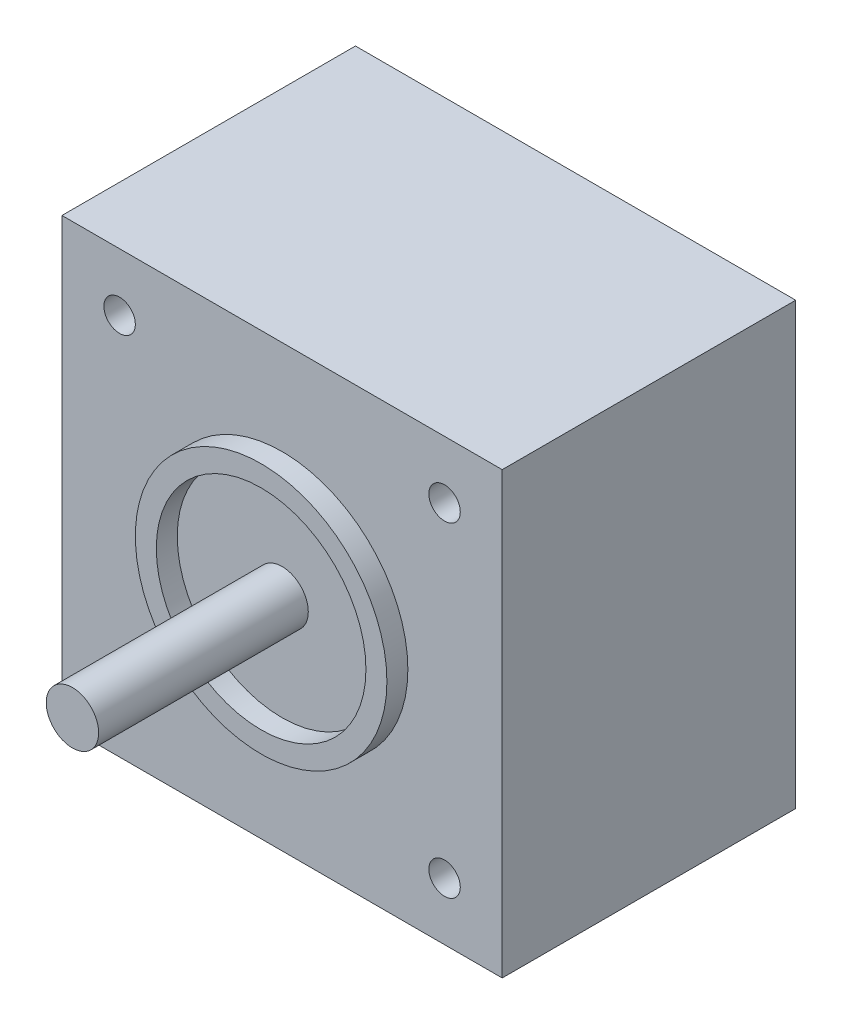
from build123d import *

# Parameters (mm, degrees)
SKETCH2_W           = 42
SKETCH2_H           = 42
BOSS_EXTRUDE1_DEPTH = 28
SKETCH3_R           = 1.5
CUT_EXTRUDE1_DEPTH  = 10
SKETCH4_R           = 12
BOSS_EXTRUDE2_DEPTH = 2
SKETCH5_R           = 10
CUT_EXTRUDE2_DEPTH  = 2
SKETCH6_R           = 2.5
BOSS_EXTRUDE3_DEPTH = 20
SKETCH7_W           = 15
SKETCH7_H           = 8
BOSS_EXTRUDE4_DEPTH = 6
SKETCH8_W           = 13
SKETCH8_H           = 6
CUT_EXTRUDE4_DEPTH  = 6


with BuildPart() as part:
    # Sketch2 → Boss-Extrude1 (new body)
    with BuildSketch(Plane.XY):
        Rectangle(SKETCH2_W, SKETCH2_H)
    extrude(amount=BOSS_EXTRUDE1_DEPTH)

    # Sketch3 → Cut-Extrude1 (cut)
    with BuildSketch(Plane.XY.offset(28)):
        with Locations((15.5, 15.5)):
            Circle(SKETCH3_R)
        with Locations((-15.5, 15.5)):
            Circle(SKETCH3_R)
        with Locations((-15.5, -15.5)):
            Circle(SKETCH3_R)
        with Locations((15.5, -15.5)):
            Circle(SKETCH3_R)
    extrude(amount=-CUT_EXTRUDE1_DEPTH, mode=Mode.SUBTRACT)

    # Sketch4 → Boss-Extrude2 (add)
    with BuildSketch(Plane.XY.offset(28)):
        Circle(SKETCH4_R)
    extrude(amount=BOSS_EXTRUDE2_DEPTH)

    # Sketch5 → Cut-Extrude2 (cut)
    with BuildSketch(Plane.XY.offset(30)):
        Circle(SKETCH5_R)
    extrude(amount=-CUT_EXTRUDE2_DEPTH, mode=Mode.SUBTRACT)

    # Sketch6 → Boss-Extrude3 (add)
    with BuildSketch(Plane.XY.offset(28)):
        Circle(SKETCH6_R)
    extrude(amount=BOSS_EXTRUDE3_DEPTH)

    # Sketch7 → Boss-Extrude4 (add)
    with BuildSketch(Plane.XZ.offset(21)):
        with Locations((0, 4)):
            Rectangle(SKETCH7_W, SKETCH7_H)
    extrude(amount=BOSS_EXTRUDE4_DEPTH)

    # Sketch8 → Cut-Extrude4 (cut)
    with BuildSketch(Plane(origin=(0, -27, 0), x_dir=(-1, 0, 0), z_dir=(0, -1, 0))):
        with Locations((0, -4)):
            Rectangle(SKETCH8_W, SKETCH8_H)
    extrude(amount=-CUT_EXTRUDE4_DEPTH, mode=Mode.SUBTRACT)


solid = part.part
